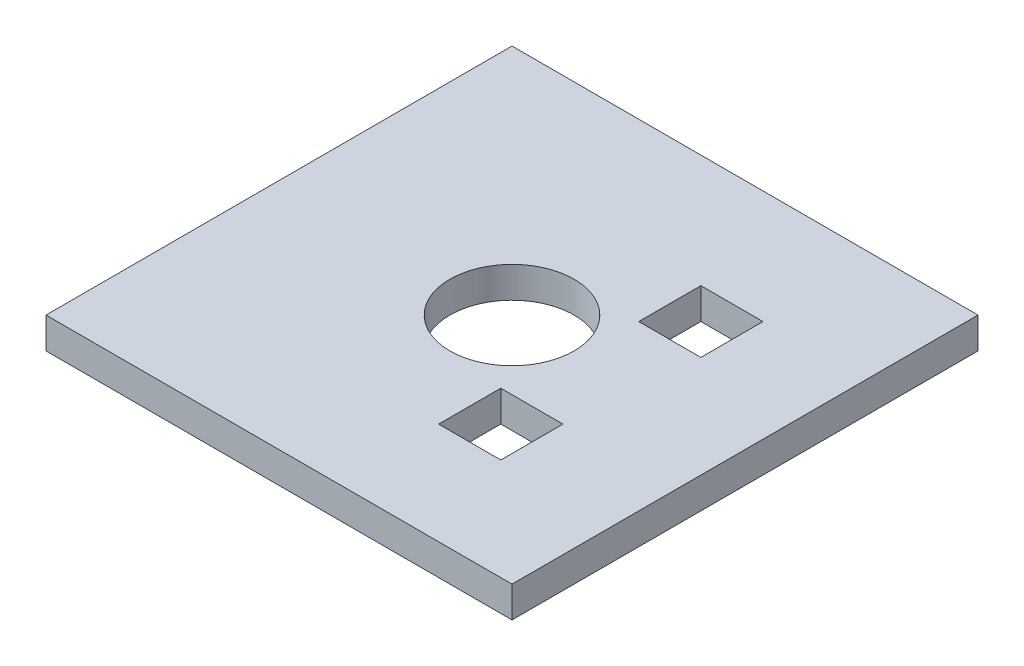
from build123d import *

# Parameters (mm, degrees)
SKETCH2_W           = 150
SKETCH2_H           = 150
SKETCH2_R           = 20
BOSS_EXTRUDE3_DEPTH = 10
SKETCH4_W           = 20
SKETCH4_H           = 20
CUT_EXTRUDE1_DEPTH  = 10


with BuildPart() as part:
    # Sketch2 → Boss-Extrude3 (new body)
    with BuildSketch(Plane(origin=(0, 0, 0), x_dir=(1, 0, 0), z_dir=(0, 1, 0))):
        Rectangle(SKETCH2_W, SKETCH2_H)
        with Locations(Location((0, 0, 0), (0, 0, 270))):
            Circle(SKETCH2_R, mode=Mode.SUBTRACT)
    extrude(amount=BOSS_EXTRUDE3_DEPTH)

    # Sketch4 → Cut-Extrude1 (cut)
    with BuildSketch(Plane(origin=(0, 10, 0), x_dir=(1, 0, 0), z_dir=(0, 1, 0))):
        with Locations((32.204911614, 28.587347761)):
            Rectangle(SKETCH4_W, SKETCH4_H)
        with Locations((28.587347761, -32.204911614)):
            Rectangle(SKETCH4_W, SKETCH4_H)
    extrude(amount=-CUT_EXTRUDE1_DEPTH, mode=Mode.SUBTRACT)


solid = part.part
